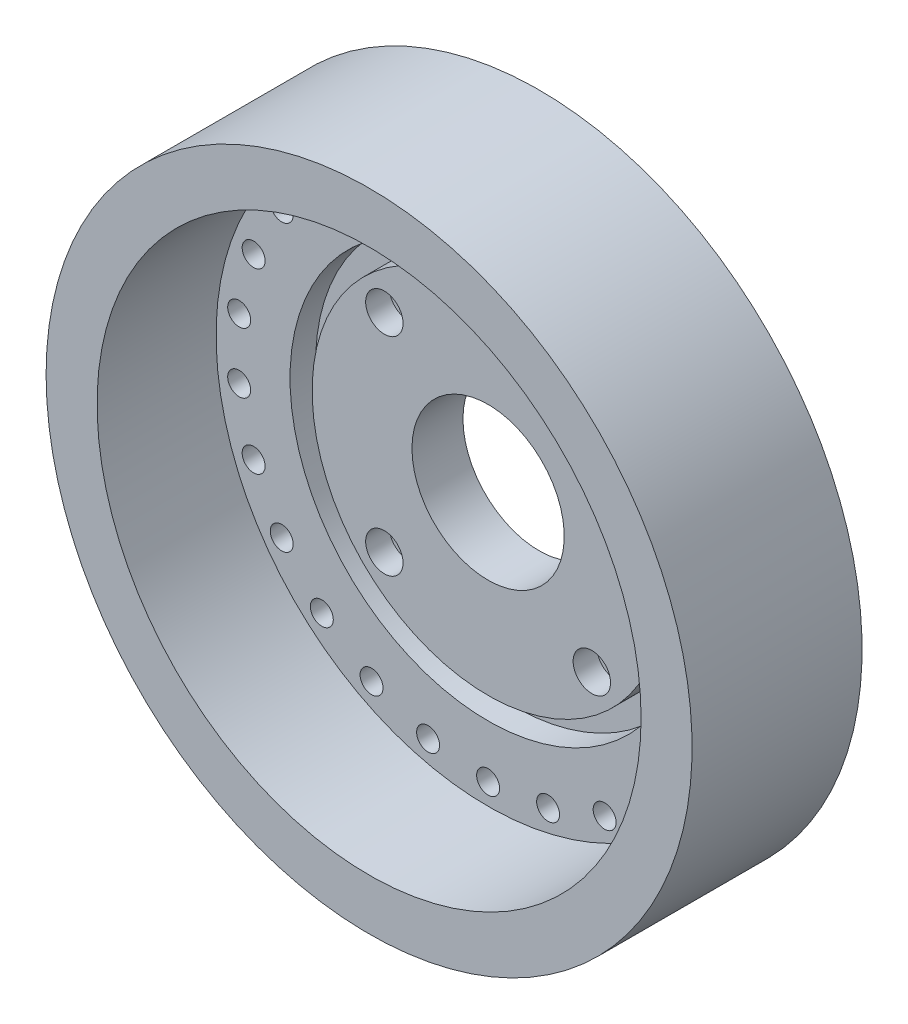
from build123d import *

# Parameters (mm, degrees)
SKETCH1_R           = 48.26
SKETCH1_R_2         = 11.375
BOSS_EXTRUDE1_DEPTH = 7.62
SKETCH3_R           = 1.7145
CUT_EXTRUDE1_DEPTH  = 3.81
SKETCH5_R           = 48.26
SKETCH5_R_2         = 40.64
BOSS_EXTRUDE2_DEPTH = 17.78
SKETCH10_R          = 2.794
CUT_EXTRUDE2_DEPTH  = 3.556
SKETCH11_R          = 2.000000064
CUT_EXTRUDE3_DEPTH  = 100.757829768
SKETCH13_R          = 29.591
SKETCH13_R_2        = 26.289
CUT_EXTRUDE7_DEPTH  = 3.81


with BuildPart() as part:
    # Sketch1 → Boss-Extrude1 (new body)
    with BuildSketch(Plane.XY):
        with Locations(Location((21.15, -21.15, 0), (0, 0, 180))):
            Circle(SKETCH1_R)
        with Locations(Location((21.15, -21.15, 0), (0, 0, 180))):
            Circle(SKETCH1_R_2, mode=Mode.SUBTRACT)
    extrude(amount=BOSS_EXTRUDE1_DEPTH)

    # Sketch3 → Cut-Extrude1 (cut)
    with BuildSketch(Plane.XY.offset(7.62)):
        with Locations((21.15, 16.315)):
            Circle(SKETCH3_R)
        with Locations((30.115961363, 15.22633519)):
            Circle(SKETCH3_R)
        with Locations((38.560853641, 12.023610001)):
            Circle(SKETCH3_R)
        with Locations((45.993890391, 6.89295518)):
            Circle(SKETCH3_R)
        with Locations((51.983090536, 0.132545736)):
            Circle(SKETCH3_R)
        with Locations((56.180383532, -7.864727907)):
            Circle(SKETCH3_R)
        with Locations((58.341837968, -16.634093274)):
            Circle(SKETCH3_R)
        with Locations((58.341837968, -25.665906726)):
            Circle(SKETCH3_R)
        with Locations((56.180383532, -34.435272093)):
            Circle(SKETCH3_R)
        with Locations((51.983090536, -42.432545736)):
            Circle(SKETCH3_R)
        with Locations((45.993890391, -49.19295518)):
            Circle(SKETCH3_R)
        with Locations((38.560853641, -54.323610001)):
            Circle(SKETCH3_R)
        with Locations((30.115961363, -57.52633519)):
            Circle(SKETCH3_R)
        with Locations((21.15, -58.615)):
            Circle(SKETCH3_R)
        with Locations((12.184038637, -57.52633519)):
            Circle(SKETCH3_R)
        with Locations((3.739146359, -54.323610001)):
            Circle(SKETCH3_R)
        with Locations((-3.693890391, -49.19295518)):
            Circle(SKETCH3_R)
        with Locations((-9.683090536, -42.432545736)):
            Circle(SKETCH3_R)
        with Locations((-13.880383532, -34.435272093)):
            Circle(SKETCH3_R)
        with Locations((-16.041837968, -25.665906726)):
            Circle(SKETCH3_R)
        with Locations((-16.041837968, -16.634093274)):
            Circle(SKETCH3_R)
        with Locations((-13.880383532, -7.864727907)):
            Circle(SKETCH3_R)
        with Locations((-9.683090536, 0.132545736)):
            Circle(SKETCH3_R)
        with Locations((-3.693890391, 6.89295518)):
            Circle(SKETCH3_R)
        with Locations((3.739146359, 12.023610001)):
            Circle(SKETCH3_R)
        with Locations((12.184038637, 15.22633519)):
            Circle(SKETCH3_R)
    extrude(amount=-CUT_EXTRUDE1_DEPTH, mode=Mode.SUBTRACT)

    # Sketch5 → Boss-Extrude2 (add)
    with BuildSketch(Plane.XY.offset(7.62)):
        with Locations(Location((21.15, -21.15, 0), (0, 0, 180))):
            Circle(SKETCH5_R)
        with Locations((21.15, -21.15)):
            Circle(SKETCH5_R_2, mode=Mode.SUBTRACT)
    extrude(amount=BOSS_EXTRUDE2_DEPTH)

    # Sketch10 → Cut-Extrude2 (cut)
    with BuildSketch(Plane.XY.offset(7.62)):
        with Locations((36.65, -36.65)):
            Circle(SKETCH10_R)
        with Locations((5.65, -36.65)):
            Circle(SKETCH10_R)
        with Locations((5.65, -5.65)):
            Circle(SKETCH10_R)
        with Locations((36.65, -5.65)):
            Circle(SKETCH10_R)
    extrude(amount=-CUT_EXTRUDE2_DEPTH, mode=Mode.SUBTRACT)

    # Sketch11 → Cut-Extrude3 (cut, through all)
    with BuildSketch(Plane.XY.offset(7.62)):
        with Locations((36.65, -36.65)):
            Circle(SKETCH11_R)
        with Locations((5.65, -36.65)):
            Circle(SKETCH11_R)
        with Locations((36.65, -5.65)):
            Circle(SKETCH11_R)
        with Locations((5.65, -5.65)):
            Circle(SKETCH11_R)
    extrude(amount=-CUT_EXTRUDE3_DEPTH, mode=Mode.SUBTRACT)

    # Sketch13 → Cut-Extrude7 (cut)
    with BuildSketch(Plane(origin=(0, 0, 7.62), x_dir=(-1, 0, 0), z_dir=(0, 0, -1))):
        with Locations(Location((-21.15, -21.15, 0), (0, 0, 180))):
            Circle(SKETCH13_R)
        with Locations(Location((-21.15, -21.15, 0), (0, 0, 180))):
            Circle(SKETCH13_R_2, mode=Mode.SUBTRACT)
    extrude(amount=CUT_EXTRUDE7_DEPTH, mode=Mode.SUBTRACT)


solid = part.part
